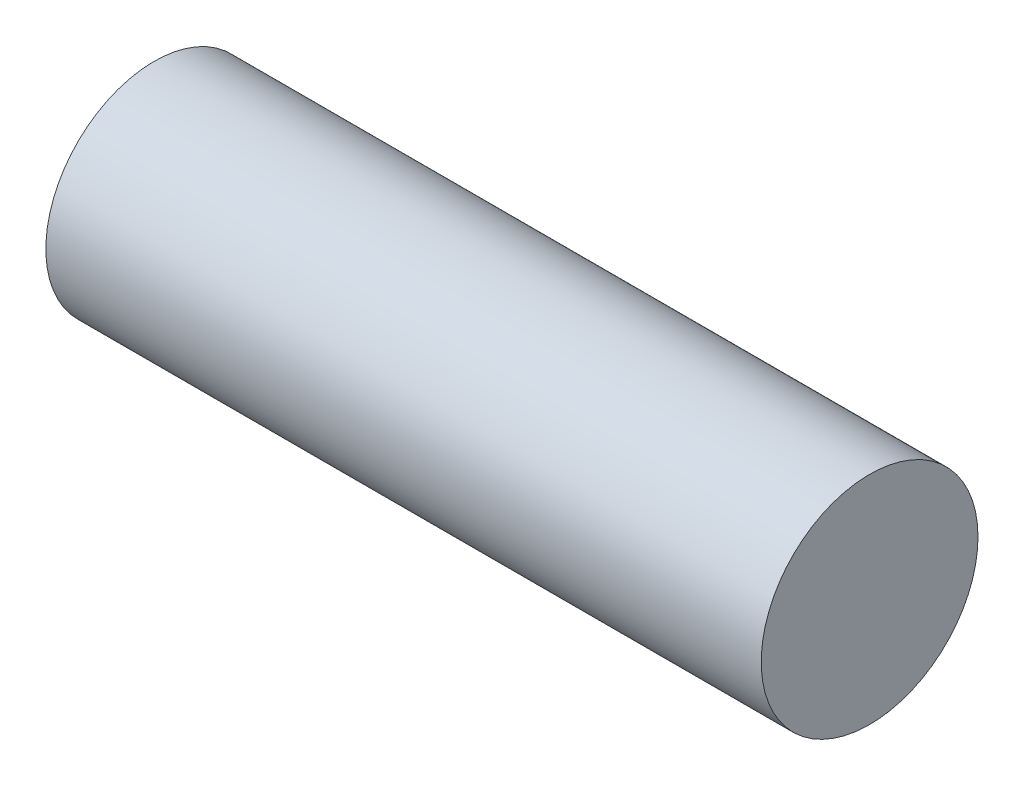
from build123d import *

# Parameters (mm, degrees)
SKETCH1_R           = 5
BOSS_EXTRUDE1_DEPTH = 33


with BuildPart() as part:
    # Sketch1 → Boss-Extrude1 (new body)
    with BuildSketch(Plane(origin=(0, 0, 0), x_dir=(0, 0, -1), z_dir=(1, 0, 0))):
        Circle(SKETCH1_R)
    extrude(amount=BOSS_EXTRUDE1_DEPTH)


solid = part.part
